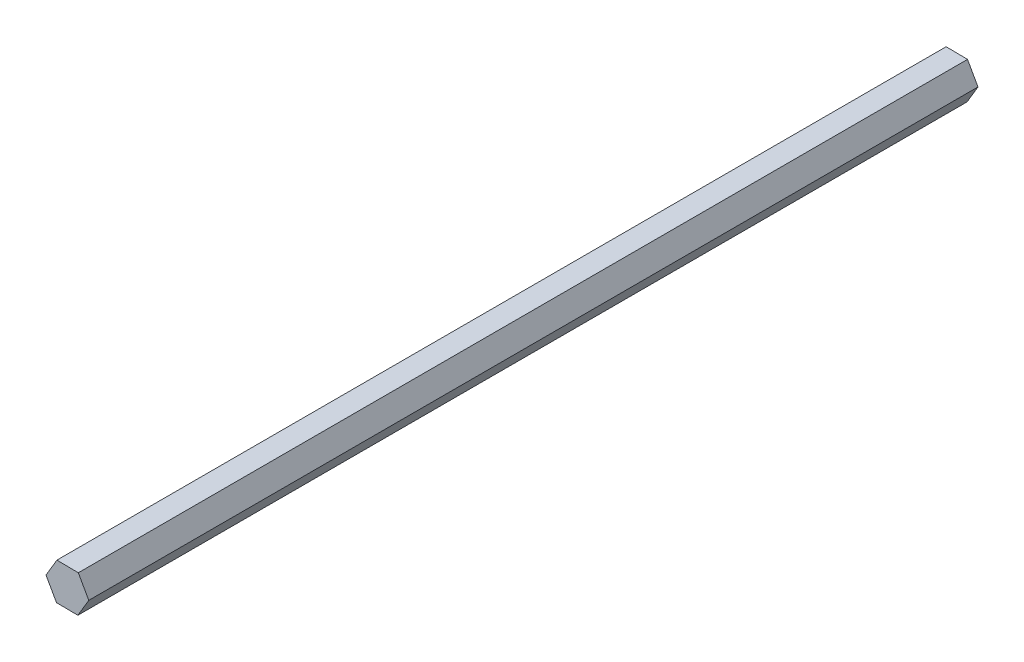
from build123d import *

# Parameters (mm, degrees)
BOSS_EXTRUDE1_DEPTH = 228.6


with BuildPart() as part:
    # Sketch1 → Boss-Extrude1 (new body)
    with BuildSketch(Plane.XY):
        Polygon((2.806881074, 4.728984419), (-2.691980104, 4.795322525), (-5.498861178, 0.066338106), (-2.806881074, -4.728984419), (2.691980104, -4.795322525), (5.498861178, -0.066338106), align=None)
    extrude(amount=BOSS_EXTRUDE1_DEPTH)


solid = part.part
